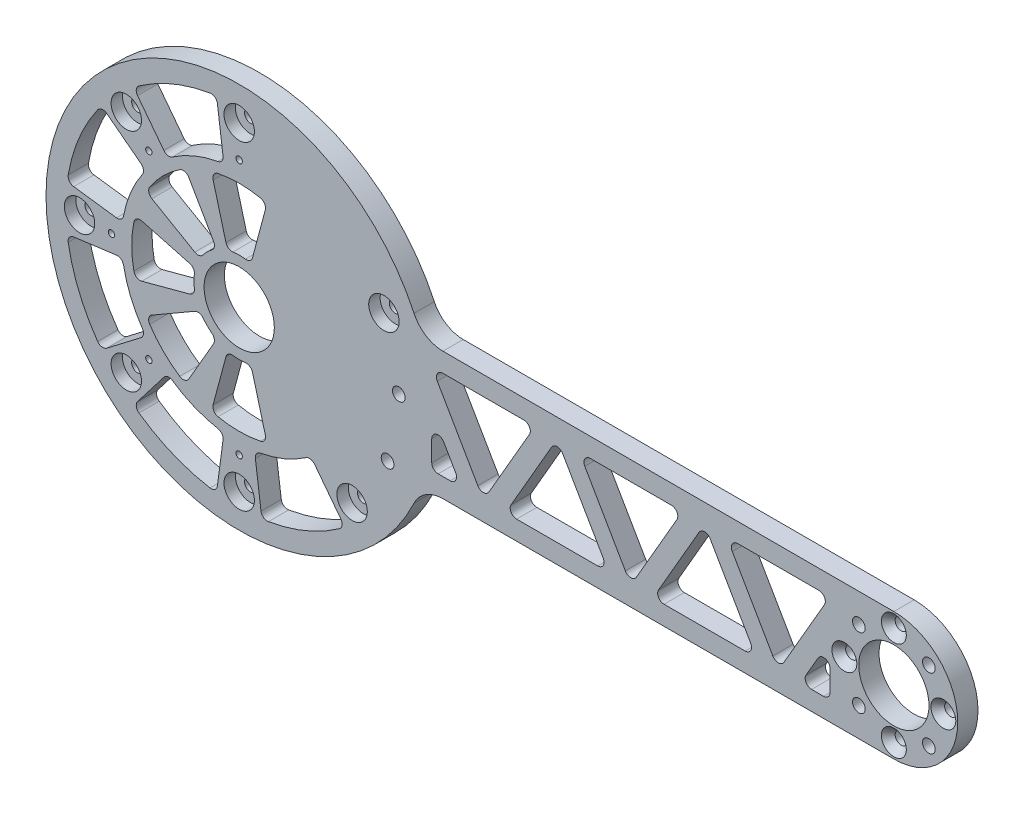
from build123d import *
from OCP.BRepFilletAPI import BRepFilletAPI_MakeChamfer

# Parameters (mm, degrees)
SKETCH1_R                = 11
SKETCH1_R_2              = 1.89865
SKETCH1_R_3              = 1.9939
SKETCH1_R_4              = 1
BOSS_EXTRUDE1_DEPTH      = 6.35
FILLET1_R                = 10
CUT_EXTRUDE1_DEPTH       = 234.078468547
FILLET2_R                = 2
CUT_EXTRUDE2_DEPTH       = 234.078468547
FILLET3_R                = 2
CIRPATTERN1_COUNT        = 8
FILLET3_OF_CIRPATTERN1_R = 2
CUT_EXTRUDE4_DEPTH       = 234.078468547
FILLET5_R                = 2
CIRPATTERN3_COUNT        = 8
FILLET5_OF_CIRPATTERN3_R = 2
CHAMFER1_SIZE            = 2.301024407
CHAMFER1_SIZE2           = 2.00025
CUT_EXTRUDE5_START       = -3.571875
SKETCH6_R                = 4.7625
SKETCH6_R_2              = 1.89865
CUT_EXTRUDE5_DEPTH       = 3.571875


with BuildPart() as part:
    # Sketch1 → Boss-Extrude1 (new body)
    with BuildSketch(Plane.XY):
        with BuildLine():
            Line((57.098598932, -20), (205, -20))
            ThreePointArc((205, -20), (225, 0), (205, 20))
            Line((205, 20), (57.098598932, 20))
            ThreePointArc((57.098598932, 20), (-60.5, 0), (57.098598932, -20))
        make_face()
        Circle(SKETCH1_R, mode=Mode.SUBTRACT)
        with Locations((45.315389352, 21.130913087)):
            Circle(SKETCH1_R_2, mode=Mode.SUBTRACT)
        with Locations((49.978847504, 1.454235937)):
            Circle(SKETCH1_R_3, mode=Mode.SUBTRACT)
        with Locations((205, 0)):
            Circle(SKETCH1_R, mode=Mode.SUBTRACT)
        with Locations((46.467376211, -18.460307366)):
            Circle(SKETCH1_R_3, mode=Mode.SUBTRACT)
        with Locations((205, -15.5)):
            Circle(SKETCH1_R_2, mode=Mode.SUBTRACT)
        with Locations((215.960155108, -10.960155108)):
            Circle(SKETCH1_R_3, mode=Mode.SUBTRACT)
        with Locations((189.5, 0)):
            Circle(SKETCH1_R_2, mode=Mode.SUBTRACT)
        with Locations((194.039844892, -10.960155108)):
            Circle(SKETCH1_R_3, mode=Mode.SUBTRACT)
        with Locations((205, 15.5)):
            Circle(SKETCH1_R_2, mode=Mode.SUBTRACT)
        with Locations((194.039844892, 10.960155108)):
            Circle(SKETCH1_R_3, mode=Mode.SUBTRACT)
        with Locations((220.5, 0)):
            Circle(SKETCH1_R_2, mode=Mode.SUBTRACT)
        with Locations((215.960155108, 10.960155108)):
            Circle(SKETCH1_R_3, mode=Mode.SUBTRACT)
        with Locations((0, -40)):
            Circle(SKETCH1_R_4, mode=Mode.SUBTRACT)
        with Locations((0, -50)):
            Circle(SKETCH1_R_2, mode=Mode.SUBTRACT)
        with Locations((-28.284271247, -28.284271247)):
            Circle(SKETCH1_R_4, mode=Mode.SUBTRACT)
        with Locations((-35.355339059, -35.355339059)):
            Circle(SKETCH1_R_2, mode=Mode.SUBTRACT)
        with Locations((-40, 0)):
            Circle(SKETCH1_R_4, mode=Mode.SUBTRACT)
        with Locations((-50, 0)):
            Circle(SKETCH1_R_2, mode=Mode.SUBTRACT)
        with Locations((-28.284271247, 28.284271247)):
            Circle(SKETCH1_R_4, mode=Mode.SUBTRACT)
        with Locations((-35.355339059, 35.355339059)):
            Circle(SKETCH1_R_2, mode=Mode.SUBTRACT)
        with Locations((0, 40)):
            Circle(SKETCH1_R_4, mode=Mode.SUBTRACT)
        with Locations((0, 50)):
            Circle(SKETCH1_R_2, mode=Mode.SUBTRACT)
        with Locations((35.355339059, -35.355339059)):
            Circle(SKETCH1_R_2, mode=Mode.SUBTRACT)
    extrude(amount=BOSS_EXTRUDE1_DEPTH)

    # Fillet1
    fillet1_edges = [part.edges().sort_by_distance(p)[0] for p in [
        (57.098598932, 20, 3.175),
        (57.098598932, -20, 3.175),
    ]]
    fillet(fillet1_edges, radius=FILLET1_R)

    # Sketch2 → Cut-Extrude1 (cut, through all)
    with BuildSketch(Plane.XY.offset(6.35)):
        Polygon((60.292341855, 14), (92.62395693, 14), (76.458149392, -14), align=None)
        Polygon((83.386352623, -14), (99.55216016, 14), (115.717967697, -14), align=None)
        Polygon((106.48036339, 14), (122.646170928, -14), (138.811978465, 14), align=None)
        Polygon((129.574374158, -14), (145.740181695, 14), (161.905989232, -14), align=None)
        Polygon((152.668384925, 14), (168.834192463, -14), (185, 14), align=None)
        Polygon((60.292341855, 2), (60.292341855, -14), (69.529946162, -14), align=None)
        Polygon((185, 2), (185, -14), (175.762395693, -14), align=None)
    extrude(amount=-CUT_EXTRUDE1_DEPTH, mode=Mode.SUBTRACT)

    # Fillet2
    fillet2_edges = [part.edges().sort_by_distance(p)[0] for p in [
        (76.458149392, -14, 3.175),
        (60.292341855, 14, 3.175),
        (92.62395693, 14, 3.175),
        (115.717967697, -14, 3.175),
        (83.386352623, -14, 3.175),
        (99.55216016, 14, 3.175),
        (106.48036339, 14, 3.175),
        (138.811978465, 14, 3.175),
        (122.646170928, -14, 3.175),
        (161.905989232, -14, 3.175),
        (129.574374158, -14, 3.175),
        (145.740181695, 14, 3.175),
        (152.668384925, 14, 3.175),
        (185, 14, 3.175),
        (168.834192463, -14, 3.175),
        (60.292341855, 2, 3.175),
        (69.529946162, -14, 3.175),
        (60.292341855, -14, 3.175),
        (175.762395693, -14, 3.175),
        (185, 2, 3.175),
        (185, -14, 3.175),
    ]]
    fillet(fillet2_edges, radius=FILLET2_R)

    # Sketch3 → Cut-Extrude2 (cut, through all)
    with BuildSketch(Plane.XY.offset(6.35)):
        with BuildLine():
            Line((-32.503404055, 8.709260868), (-13.691998588, 3.668759964))
            ThreePointArc((-13.691998588, 3.668759964), (-14.175, 0), (-13.691998588, -3.668759964))
            Line((-13.691998588, -3.668759964), (-32.503404055, -8.709260868))
            ThreePointArc((-32.503404055, -8.709260868), (-33.65, 0), (-32.503404055, 8.709260868))
        make_face()
    cut_extrude2 = extrude(amount=-CUT_EXTRUDE2_DEPTH, mode=Mode.SUBTRACT)

    # Fillet3
    fillet3_edges = [part.edges().sort_by_distance(p)[0] for p in [
        (-13.691998588, 3.668759964, 3.175),
        (-13.691998588, -3.668759964, 3.175),
        (-32.503404055, -8.709260868, 3.175),
        (-32.503404055, 8.709260868, 3.175),
    ]]
    fillet(fillet3_edges, radius=FILLET3_R)

    # CirPattern1: Cut-Extrude2 ×8 about axis, 3 skipped
    cirpattern1_axis = Axis((0, 0, 0), (0, 0, -1))
    add([cut_extrude2.rotate(cirpattern1_axis, i * 360 / CIRPATTERN1_COUNT) for i in range(1, CIRPATTERN1_COUNT) if i not in (3, 4, 5)], mode=Mode.SUBTRACT)

    # Fillet3 of CirPattern1
    fillet3_of_cirpattern1_edges = [part.edges().sort_by_distance(p)[0] for p in [
        (-7.0875, 12.275910099, 3.175),
        (-12.275910099, 7.0875, 3.175),
        (-29.141754837, 16.825, 3.175),
        (-16.825, 29.141754837, 3.175),
        (3.668759964, 13.691998588, 3.175),
        (-3.668759964, 13.691998588, 3.175),
        (-8.709260868, 32.503404055, 3.175),
        (8.709260868, 32.503404055, 3.175),
        (-3.668759964, -13.691998588, 3.175),
        (3.668759964, -13.691998588, 3.175),
        (8.709260868, -32.503404055, 3.175),
        (-8.709260868, -32.503404055, 3.175),
        (-12.275910099, -7.0875, 3.175),
        (-7.0875, -12.275910099, 3.175),
        (-16.825, -29.141754837, 3.175),
        (-29.141754837, -16.825, 3.175),
    ]]
    fillet(fillet3_of_cirpattern1_edges, radius=FILLET3_OF_CIRPATTERN1_R)

    # Sketch5 → Cut-Extrude4 (cut, through all)
    with BuildSketch(Plane.XY.offset(6.35)):
        with BuildLine():
            Line((-53.860242094, 7.090835392), (-36.50995702, 4.806627029))
            ThreePointArc((-36.50995702, 4.806627029), (-34.021863785, 14.092317397), (-29.215236756, 22.417639623))
            Line((-29.215236756, 22.417639623), (-43.098920211, 33.070964631))
            ThreePointArc((-43.098920211, 33.070964631), (-50.189755604, 20.789277463), (-53.860242094, 7.090835392))
        make_face()
    cut_extrude4 = extrude(amount=-CUT_EXTRUDE4_DEPTH, mode=Mode.SUBTRACT)

    # Fillet5
    fillet5_edges = [part.edges().sort_by_distance(p)[0] for p in [
        (-29.215236756, 22.417639623, 3.175),
        (-36.50995702, 4.806627029, 3.175),
        (-53.860242094, 7.090835392, 3.175),
        (-43.098920211, 33.070964631, 3.175),
    ]]
    fillet(fillet5_edges, radius=FILLET5_R)

    # CirPattern3: Cut-Extrude4 ×8 about axis, 3 skipped
    cirpattern3_axis = Axis((0, 0, 0), (0, 0, -1))
    add([cut_extrude4.rotate(cirpattern3_axis, i * 360 / CIRPATTERN3_COUNT) for i in range(1, CIRPATTERN3_COUNT) if i not in (2, 3, 4)], mode=Mode.SUBTRACT)

    # Fillet5 of CirPattern3
    fillet5_of_cirpattern3_edges = [part.edges().sort_by_distance(p)[0] for p in [
        (-4.806627029, 36.50995702, 3.175),
        (-22.417639623, 29.215236756, 3.175),
        (-33.070964631, 43.098920211, 3.175),
        (-7.090835392, 53.860242094, 3.175),
        (4.806627029, -36.50995702, 3.175),
        (22.417639623, -29.215236756, 3.175),
        (33.070964631, -43.098920211, 3.175),
        (7.090835392, -53.860242094, 3.175),
        (-22.417639623, -29.215236756, 3.175),
        (-4.806627029, -36.50995702, 3.175),
        (-7.090835392, -53.860242094, 3.175),
        (-33.070964631, -43.098920211, 3.175),
        (-36.50995702, -4.806627029, 3.175),
        (-29.215236756, -22.417639623, 3.175),
        (-43.098920211, -33.070964631, 3.175),
        (-53.860242094, -7.090835392, 3.175),
    ]]
    fillet(fillet5_of_cirpattern3_edges, radius=FILLET5_OF_CIRPATTERN3_R)

    # Chamfer1: one chamfer whose edges measure the first distance from different faces: ONE call of the kernel's chamfer builder (chamfer() names one face for all edges)
    chamfer1_edges_1 = [part.edges().sort_by_distance(p)[0] for p in [
        (203.10135, -15.5, 6.35),
    ]]
    chamfer1_side_1 = [part.faces().sort_by_distance(p)[0] for p in [
        (203.10135, -15.5, 3.175),
    ]]
    chamfer1_edges_2 = [part.edges().sort_by_distance(p)[0] for p in [
        (187.60135, 0, 6.35),
    ]]
    chamfer1_side_2 = [part.faces().sort_by_distance(p)[0] for p in [
        (187.60135, 0, 3.175),
    ]]
    chamfer1_edges_3 = [part.edges().sort_by_distance(p)[0] for p in [
        (203.10135, 15.5, 6.35),
    ]]
    chamfer1_side_3 = [part.faces().sort_by_distance(p)[0] for p in [
        (203.10135, 15.5, 3.175),
    ]]
    chamfer1_edges_4 = [part.edges().sort_by_distance(p)[0] for p in [
        (218.60135, 0, 6.35),
    ]]
    chamfer1_side_4 = [part.faces().sort_by_distance(p)[0] for p in [
        (218.60135, 0, 3.175),
    ]]
    chamfer1 = BRepFilletAPI_MakeChamfer(part.part.solid().wrapped)
    for e in chamfer1_edges_1:
        chamfer1.Add(CHAMFER1_SIZE, CHAMFER1_SIZE2, e.wrapped, chamfer1_side_1[0].wrapped)  # the first distance lies on this face
    for e in chamfer1_edges_2:
        chamfer1.Add(CHAMFER1_SIZE, CHAMFER1_SIZE2, e.wrapped, chamfer1_side_2[0].wrapped)  # the first distance lies on this face
    for e in chamfer1_edges_3:
        chamfer1.Add(CHAMFER1_SIZE, CHAMFER1_SIZE2, e.wrapped, chamfer1_side_3[0].wrapped)  # the first distance lies on this face
    for e in chamfer1_edges_4:
        chamfer1.Add(CHAMFER1_SIZE, CHAMFER1_SIZE2, e.wrapped, chamfer1_side_4[0].wrapped)  # the first distance lies on this face
    add(Compound.cast(chamfer1.Shape()), mode=Mode.REPLACE)

    # Sketch6 → Cut-Extrude5 (cut)
    # profile 1 of 7: a face of its own
    with BuildSketch(Plane.XY.offset(6.35).offset(CUT_EXTRUDE5_START)):
        with Locations((0, 50)):
            Circle(SKETCH6_R)
        with Locations((0, 50)):
            Circle(SKETCH6_R_2, mode=Mode.SUBTRACT)
    # profile 2 of 7: a face of its own
    with BuildSketch(Plane.XY.offset(6.35).offset(CUT_EXTRUDE5_START)):
        with Locations((-35.355339059, 35.355339059)):
            Circle(SKETCH6_R)
        with Locations((-35.355339059, 35.355339059)):
            Circle(SKETCH6_R_2, mode=Mode.SUBTRACT)
    # profile 3 of 7: a face of its own
    with BuildSketch(Plane.XY.offset(6.35).offset(CUT_EXTRUDE5_START)):
        with Locations((-50, 0)):
            Circle(SKETCH6_R)
        with Locations((-50, 0)):
            Circle(SKETCH6_R_2, mode=Mode.SUBTRACT)
    # profile 4 of 7: a face of its own
    with BuildSketch(Plane.XY.offset(6.35).offset(CUT_EXTRUDE5_START)):
        with Locations((-35.355339059, -35.355339059)):
            Circle(SKETCH6_R)
        with Locations((-35.355339059, -35.355339059)):
            Circle(SKETCH6_R_2, mode=Mode.SUBTRACT)
    # profile 5 of 7: a face of its own
    with BuildSketch(Plane.XY.offset(6.35).offset(CUT_EXTRUDE5_START)):
        with Locations((0, -50)):
            Circle(SKETCH6_R)
        with Locations((0, -50)):
            Circle(SKETCH6_R_2, mode=Mode.SUBTRACT)
    # profile 6 of 7: a face of its own
    with BuildSketch(Plane.XY.offset(6.35).offset(CUT_EXTRUDE5_START)):
        with Locations((35.355339059, -35.355339059)):
            Circle(SKETCH6_R)
        with Locations((35.355339059, -35.355339059)):
            Circle(SKETCH6_R_2, mode=Mode.SUBTRACT)
    # profile 7 of 7: a face of its own
    with BuildSketch(Plane.XY.offset(6.35).offset(CUT_EXTRUDE5_START)):
        with Locations((45.315389352, 21.130913087)):
            Circle(SKETCH6_R)
        with Locations((45.315389352, 21.130913087)):
            Circle(SKETCH6_R_2, mode=Mode.SUBTRACT)
    extrude(amount=CUT_EXTRUDE5_DEPTH, mode=Mode.SUBTRACT)


solid = part.part
